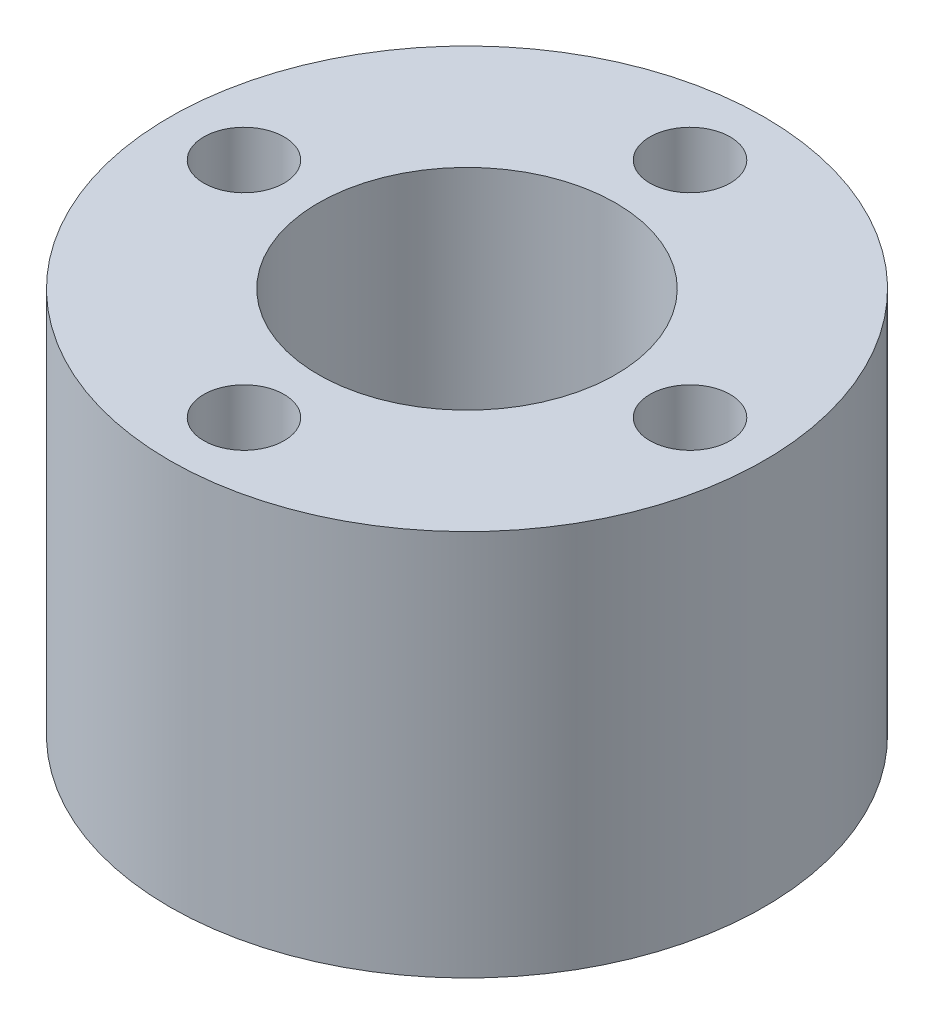
from build123d import *

# Parameters (mm, degrees)
SKETCH_1_R               = 10
SKETCH_1_R_2             = 5
EXTRUDE_1_DEPTH          = 13
SKETCH_2_R               = 1.35
CUT_EXTRUDE_1_DEPTH      = 6.5
PATTERN_CIRCULAR_1_COUNT = 4


with BuildPart() as part:
    # 草图1 → 凸台-拉伸1 (new body)
    with BuildSketch(Plane(origin=(0, 0, 0), x_dir=(1, 0, 0), z_dir=(0, 1, 0))):
        with Locations(Location((0, 0, 0), (0, 0, 90))):
            Circle(SKETCH_1_R)
        with Locations(Location((0, 0, 0), (0, 0, 90))):
            Circle(SKETCH_1_R_2, mode=Mode.SUBTRACT)
    extrude(amount=EXTRUDE_1_DEPTH)

    # 草图2 → 切除-拉伸1 (cut)
    with BuildSketch(Plane(origin=(0, 13, 0), x_dir=(1, 0, 0), z_dir=(0, 1, 0))):
        with Locations(Location((0, 7.5, 0), (0, 0, 270))):
            Circle(SKETCH_2_R)
    cut_extrude_1 = extrude(amount=-CUT_EXTRUDE_1_DEPTH, mode=Mode.SUBTRACT)

    # 草图5 → M2.5 螺纹孔1 (revolve, cut)
    with BuildSketch(Plane(origin=(0, 6.5, -7.5), x_dir=(0, 0, 1), z_dir=(1, 0, 0))):
        Polygon((0, 0), (0, 27.865882135), (1.025, 27.25), (1.025, 0), align=None)
    hole_wizard_m2_5_1 = revolve(axis=Axis((0, 12.85, -7.5), (0, -1, 0)), mode=Mode.SUBTRACT)

    # 阵列(圆周)1: 切除-拉伸1, M2.5 螺纹孔1 ×4 about axis
    pattern_circular_1_axis = Axis((0, 0, 0), (0, 1, 0))
    add([cut_extrude_1.rotate(pattern_circular_1_axis, i * 360 / PATTERN_CIRCULAR_1_COUNT) for i in range(1, PATTERN_CIRCULAR_1_COUNT)], mode=Mode.SUBTRACT)
    add([hole_wizard_m2_5_1.rotate(pattern_circular_1_axis, i * 360 / PATTERN_CIRCULAR_1_COUNT) for i in range(1, PATTERN_CIRCULAR_1_COUNT)], mode=Mode.SUBTRACT)


solid = part.part
